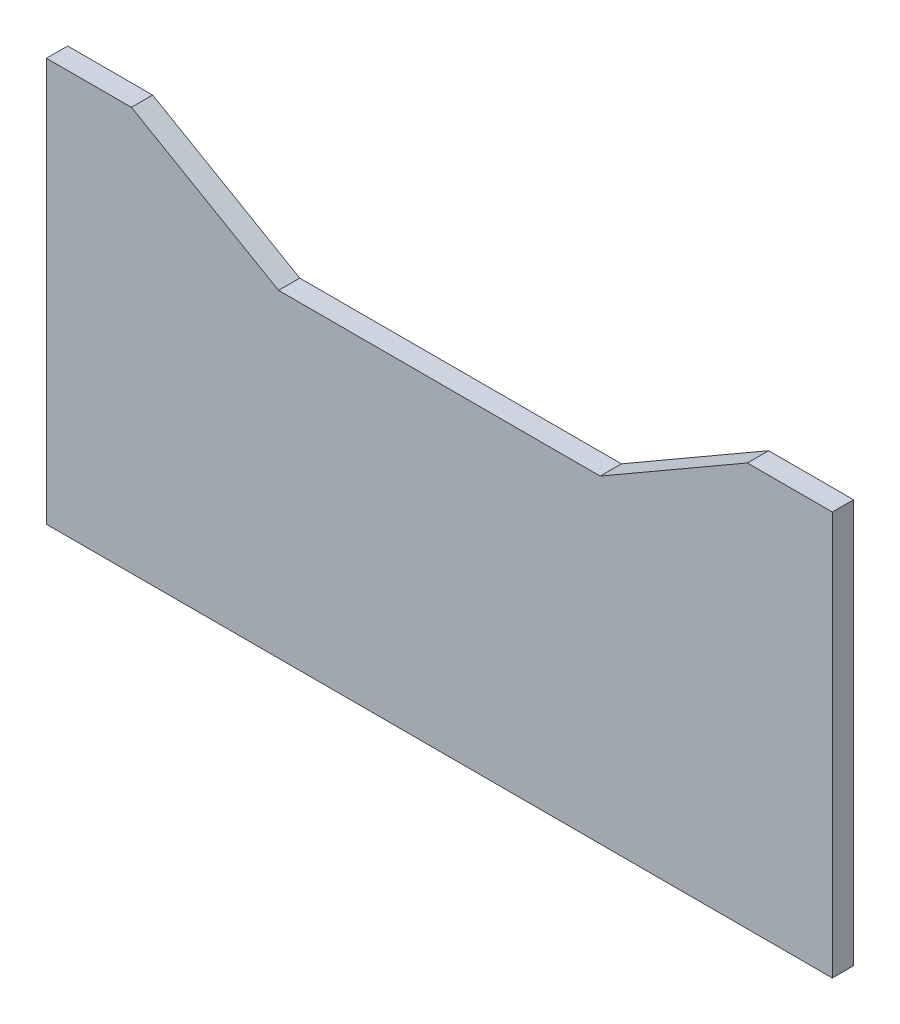
from build123d import *

# Parameters (mm, degrees)
BOSS_EXTRU_1_DEPTH = 10


with BuildPart() as part:
    # Esquisse1 → Boss.-Extru.1 (new body)
    with BuildSketch(Plane.XY):
        Polygon((0, 0), (370, 0), (370, 190), (330, 190), (260.717967697, 150), (109.282032303, 150), (40, 190), (0, 190), align=None)
    extrude(amount=BOSS_EXTRU_1_DEPTH)


solid = part.part
